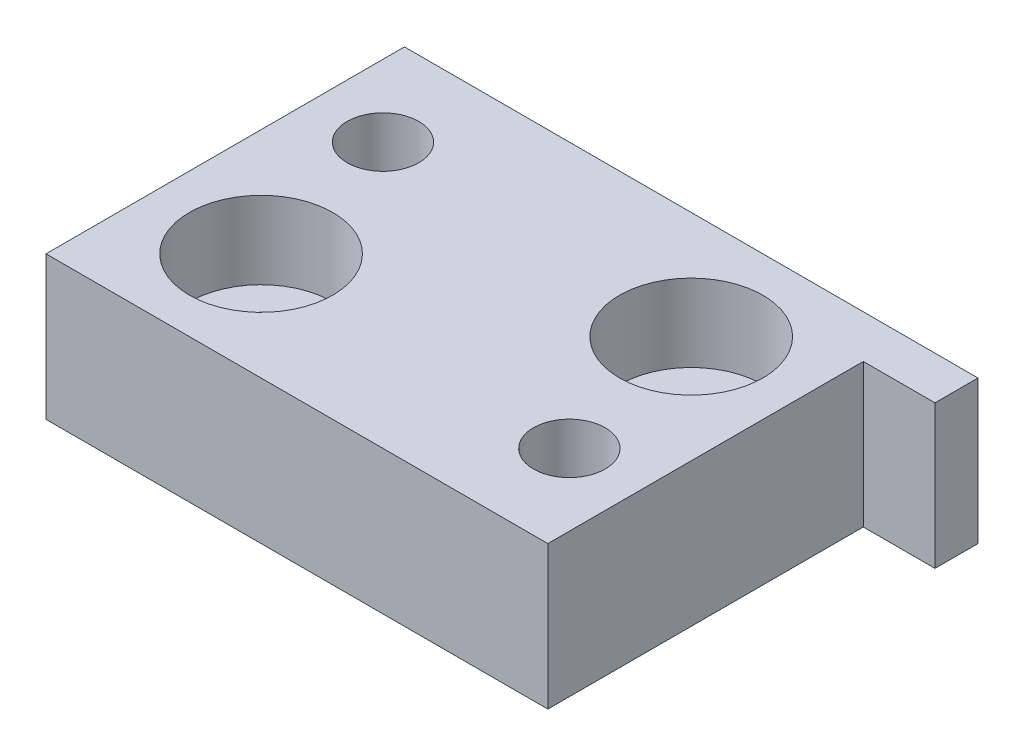
from build123d import *

# Parameters (mm, degrees)
SKETCH1_W                                           = 40
SKETCH1_H                                           = 25
BOSS_EXTRUDE1_DEPTH                                 = 10
CUT_EXTRUDE2_REACH                                  = 27.617
SKETCH3_W                                           = 5
SKETCH3_H                                           = 22
F_5_0MM_DOWEL_HOLE1_D                               = 5
CBORE_FOR_M5_HEX_SOCKET_HEAD_CAP_SCREW1_D           = 5.3
CBORE_FOR_M5_HEX_SOCKET_HEAD_CAP_SCREW1_CBORE_D     = 10
CBORE_FOR_M5_HEX_SOCKET_HEAD_CAP_SCREW1_CBORE_DEPTH = 5.4


with BuildPart() as part:
    # Sketch1 → Boss-Extrude1 (new body)
    with BuildSketch(Plane(origin=(0, 0, 0), x_dir=(1, 0, 0), z_dir=(0, 1, 0))):
        Rectangle(SKETCH1_W, SKETCH1_H)
    extrude(amount=BOSS_EXTRUDE1_DEPTH)

    # Sketch3 → Cut-Extrude2 (cut, up to next)
    with BuildSketch(Plane(origin=(0, 10, 0), x_dir=(1, 0, 0), z_dir=(0, 1, 0)), mode=Mode.PRIVATE) as cut_extrude2_sk1:
        with Locations((17.5, -1.5)):
            Rectangle(SKETCH3_W, SKETCH3_H)
    cut_extrude2_tool1 = extrude(cut_extrude2_sk1.sketch, amount=-CUT_EXTRUDE2_REACH, mode=Mode.PRIVATE) & part.part
    add(cut_extrude2_tool1.solids().sort_by_distance((17.5, 10, 1.5))[0], mode=Mode.SUBTRACT)

    # Ø5.0mm Dowel Hole1 (through all)
    with Locations(Plane(origin=(0, 10, 0), x_dir=(1, 0, 0), z_dir=(0, 1, 0))):
        with Locations((-15, 6), (10, -6)):
            Hole(F_5_0MM_DOWEL_HOLE1_D / 2)

    # CBORE for M5 Hex Socket Head Cap Screw1 (through all)
    with Locations(Plane(origin=(0, 10, 0), x_dir=(1, 0, 0), z_dir=(0, 1, 0))):
        with Locations((-12.5, -5), (7.5, 5)):
            CounterBoreHole(CBORE_FOR_M5_HEX_SOCKET_HEAD_CAP_SCREW1_D / 2, CBORE_FOR_M5_HEX_SOCKET_HEAD_CAP_SCREW1_CBORE_D / 2, CBORE_FOR_M5_HEX_SOCKET_HEAD_CAP_SCREW1_CBORE_DEPTH)


solid = part.part
